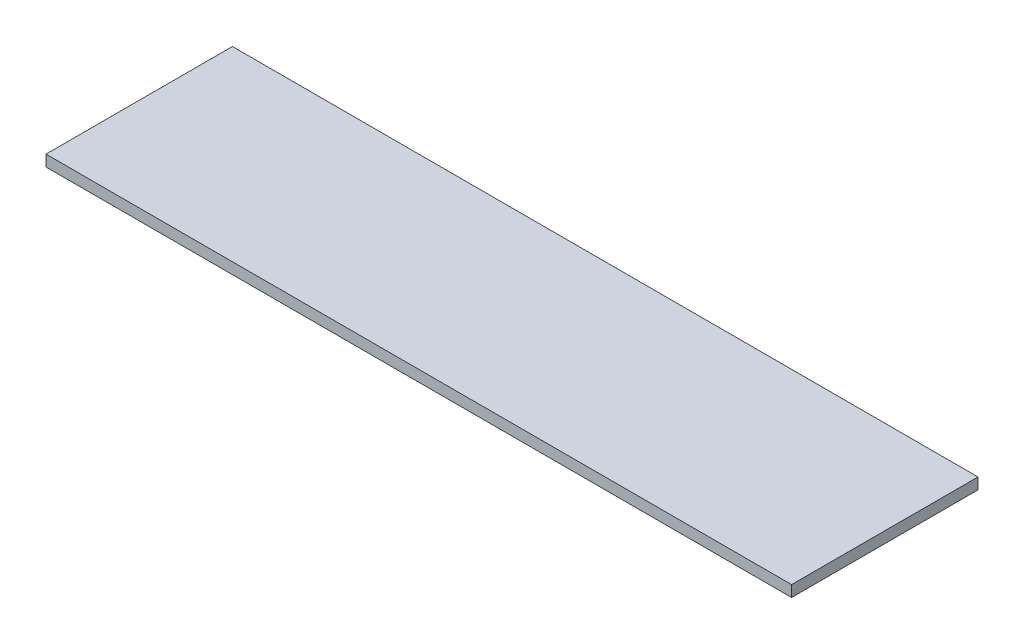
from build123d import *

# Parameters (mm, degrees)
SKETCH_1_W      = 200
SKETCH_1_H      = 50
EXTRUDE_1_DEPTH = 3


with BuildPart() as part:
    # 草图1 → 凸台-拉伸1 (new body)
    with BuildSketch(Plane(origin=(0, 0, 0), x_dir=(1, 0, 0), z_dir=(0, 1, 0))):
        Rectangle(SKETCH_1_W, SKETCH_1_H)
    extrude(amount=EXTRUDE_1_DEPTH)


solid = part.part
